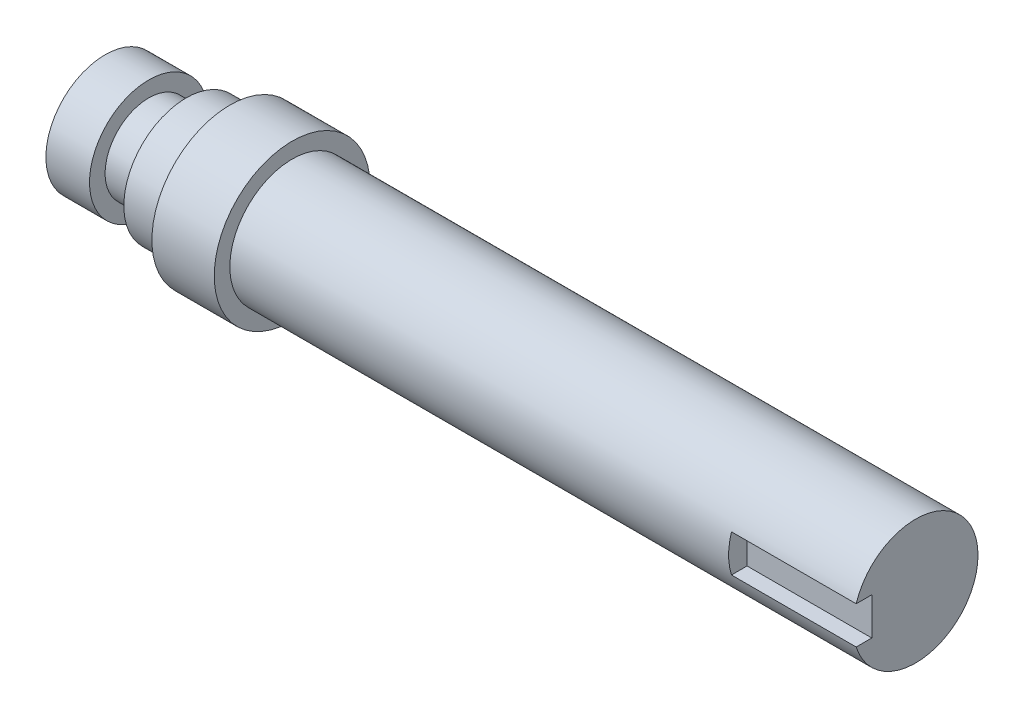
from build123d import *

# Parameters (mm, degrees)
CUT_EXTRUDE1_DEPTH = 20


with BuildPart() as part:
    # Sketch1 → Revolve1 (revolve)
    with BuildSketch(Plane.XY, mode=Mode.PRIVATE) as revolve1_sk:
        Polygon((0, 0), (0, 9.5), (7, 9.5), (7, 7), (13, 7), (13, 10), (20, 10), (20, 12.5), (30, 12.5), (30, 10), (130, 10), (130, 0), align=None)
    revolve(revolve1_sk.sketch.rotate(Axis((130, 0, 0), (-1, 0, 0)), 90), axis=Axis((130, 0, 0), (-1, 0, 0)))

    # Sketch2 → Cut-Extrude1 (cut)
    with BuildSketch(Plane(origin=(130, 0, 0), x_dir=(0, 0, -1), z_dir=(1, 0, 0))):
        with BuildLine():
            Line((-9.539392014, 3), (-7.039392014, 3))
            Line((-7.039392014, 3), (-7.039392014, -3))
            Line((-7.039392014, -3), (-9.539392014, -3))
            ThreePointArc((-9.539392014, -3), (-10, 0), (-9.539392014, 3))
        make_face()
    extrude(amount=-CUT_EXTRUDE1_DEPTH, mode=Mode.SUBTRACT)


solid = part.part
